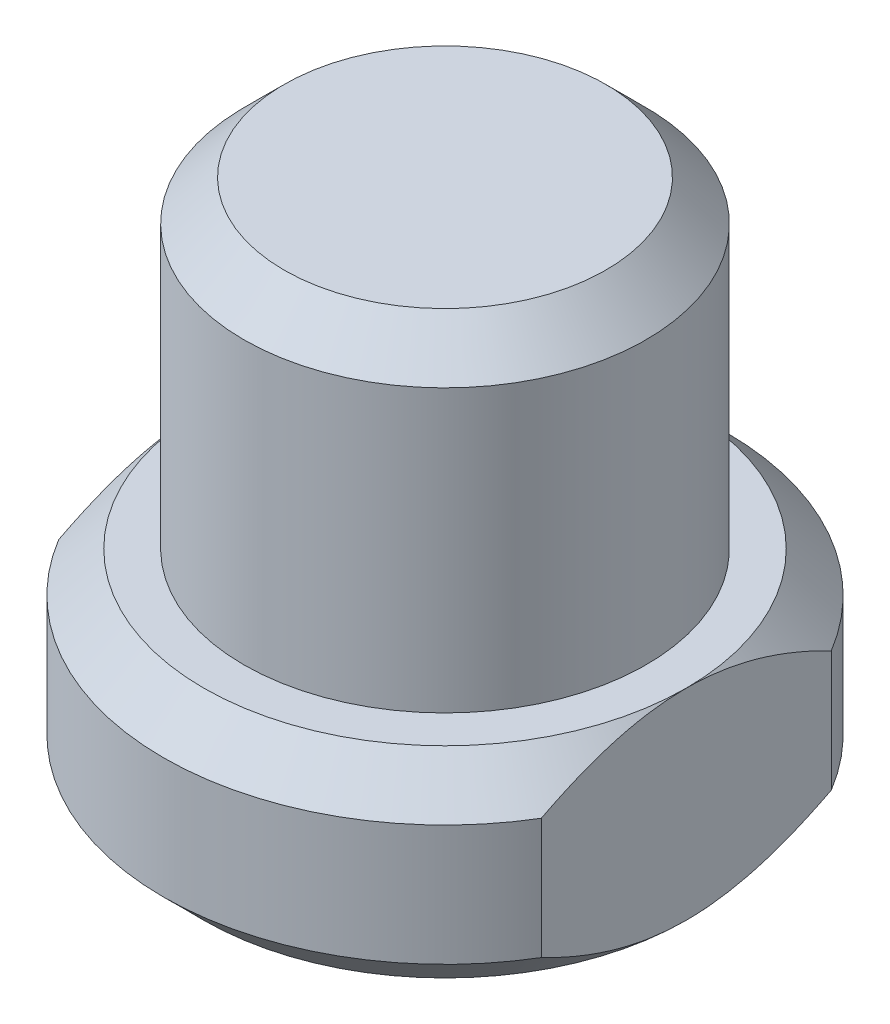
from build123d import *

# Parameters (mm, degrees)
SKIZZE3_W                       = 5
SKIZZE3_H                       = 23
SCHNITT_LINEAR_AUSTRAGEN1_DEPTH = 9


with BuildPart() as part:
    # Skizze2 → Rotation1 (revolve)
    with BuildSketch(Plane(origin=(0, 0, 0), x_dir=(0, 0, -1), z_dir=(1, 0, 0)), mode=Mode.PRIVATE) as rotation1_sk:
        Polygon((0, 0), (6, 0), (7, 1), (7, 4), (6, 5), (5, 5), (5, 12), (4, 13), (0, 13), align=None)
    revolve(rotation1_sk.sketch.rotate(Axis((0, 0, 0), (0, -1, 0)), 180), axis=Axis((0, 0, 0), (0, -1, 0)))

    # Skizze3 → Schnitt-Linear austragen1 (cut)
    with BuildSketch(Plane(origin=(0, 5, 0), x_dir=(1, 0, 0), z_dir=(0, 1, 0))):
        with Locations((8.5, 0)):
            Rectangle(SKIZZE3_W, SKIZZE3_H)
        with Locations((-8.5, 0)):
            Rectangle(SKIZZE3_W, SKIZZE3_H)
    extrude(amount=-SCHNITT_LINEAR_AUSTRAGEN1_DEPTH, mode=Mode.SUBTRACT)


solid = part.part
